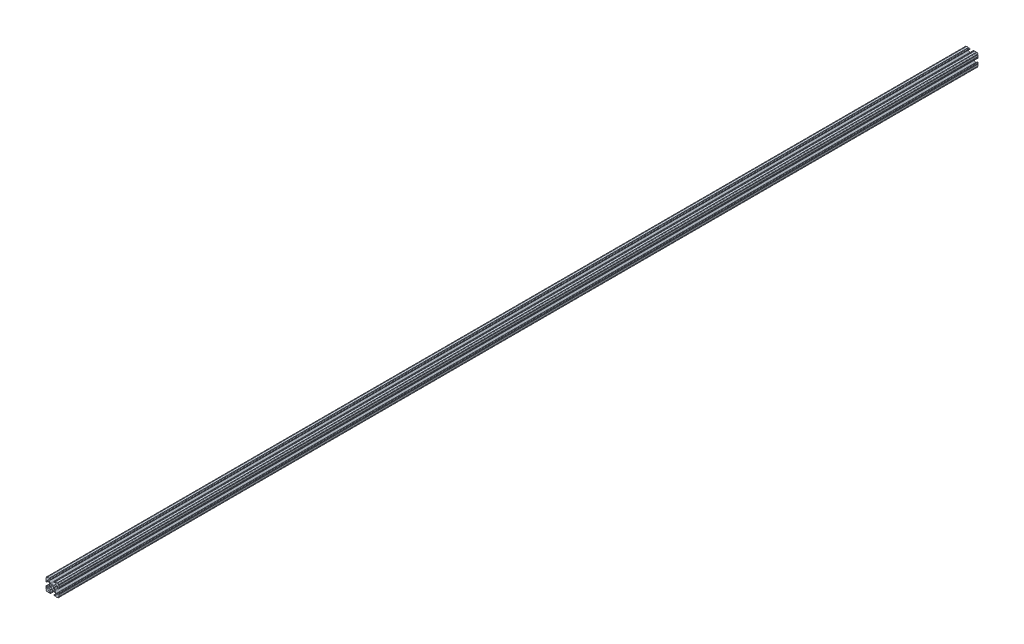
from build123d import *

# Parameters (mm, degrees)
BOSS_EXTRUDE1_DEPTH     = 1524
CUT_EXTRUDE1_DEPTH      = 1525.105829659
CUT_EXTRUDE1_DEPTH_BACK = 1525.105829659
SKETCH5_R               = 0.55245
CUT_EXTRUDE2_DEPTH      = 1525.105829659
CUT_EXTRUDE2_DEPTH_BACK = 1525.105829659
SKETCH8_W               = 50.559993734
SKETCH8_H               = 1231.9


with BuildPart() as part:
    # Sketch4 → Boss-Extrude1 (new, symmetric)
    with BuildSketch(Plane.XY):
        with BuildLine():
            Line((4.190365, -12.7), (10.11729625, -12.7))
            ThreePointArc((10.11729625, -12.7), (11.943543585, -11.943543585), (12.7, -10.11729625))
            Line((12.7, -10.11729625), (12.7, -4.190365))
            ThreePointArc((12.7, -4.190365), (12.42492494, -3.52627506), (11.760835, -3.2512))
            Line((11.760835, -3.2512), (11.429365, -3.2512))
            ThreePointArc((11.429365, -3.2512), (10.76527506, -3.52627506), (10.4902, -4.190365))
            Line((10.4902, -4.190365), (10.4902, -6.348478019))
            ThreePointArc((10.4902, -6.348478019), (9.830707141, -7.335478831), (8.666460301, -7.103895736))
            Line((8.666460301, -7.103895736), (5.299899128, -3.737334563))
            ThreePointArc((5.299899128, -3.737334563), (4.817571085, -3.015479634), (4.6482, -2.16399369))
            Line((4.6482, -2.16399369), (4.6482, 0))
            Line((4.6482, 0), (2.6035, 0))
            ThreePointArc((2.6035, 0), (1.840952505, -1.840952505), (0, -2.6035))
            Line((0, -2.6035), (0, -4.6482))
            Line((0, -4.6482), (2.16399369, -4.6482))
            ThreePointArc((2.16399369, -4.6482), (3.015479634, -4.817571085), (3.737334563, -5.299899128))
            Line((3.737334563, -5.299899128), (7.103895736, -8.666460301))
            ThreePointArc((7.103895736, -8.666460301), (7.335478831, -9.830707141), (6.348478019, -10.4902))
            Line((6.348478019, -10.4902), (4.190365, -10.4902))
            ThreePointArc((4.190365, -10.4902), (3.52627506, -10.76527506), (3.2512, -11.429365))
            Line((3.2512, -11.429365), (3.2512, -11.760835))
            ThreePointArc((3.2512, -11.760835), (3.52627506, -12.42492494), (4.190365, -12.7))
        make_face()
    extrude(amount=BOSS_EXTRUDE1_DEPTH, both=True)

    # Sketch5 → Cut-Extrude1 (cut, two sides: drawn at the far end of the back side and taken through both)
    with BuildSketch(Plane.XY.offset(-CUT_EXTRUDE1_DEPTH_BACK)):
        with Locations((10.356153152, -12.7)):
            Circle(SKETCH5_R)
        with Locations((5.796028019, -12.7)):
            Circle(SKETCH5_R)
        with Locations((12.7, -10.356153152)):
            Circle(SKETCH5_R)
        with Locations((12.7, -5.796028019)):
            Circle(SKETCH5_R)
    extrude(amount=CUT_EXTRUDE1_DEPTH + CUT_EXTRUDE1_DEPTH_BACK, mode=Mode.SUBTRACT)

    # Mirror1: part across plane


with BuildPart() as part_1:
    add(part.part)
    add(part.part.mirror(Plane(origin=(0, 0, 0), x_dir=(0, 0, 1), z_dir=(1, 0, 0))))

    # Mirror2: part across plane


with BuildPart() as part_2:
    add(part_1.part)
    add(part_1.part.mirror(Plane.ZX))

    # Sketch8 → Cut-Extrude2 (cut, two sides: drawn at the far end of the back side and taken through both)
    with BuildSketch(Plane(origin=(0, 0, 0), x_dir=(1, 0, 0), z_dir=(0, 1, 0)).offset(-CUT_EXTRUDE2_DEPTH_BACK)):
        with Locations((0, 920.75)):
            Rectangle(SKETCH8_W, SKETCH8_H)
    extrude(amount=CUT_EXTRUDE2_DEPTH + CUT_EXTRUDE2_DEPTH_BACK, mode=Mode.SUBTRACT)


solid = part_2.part
